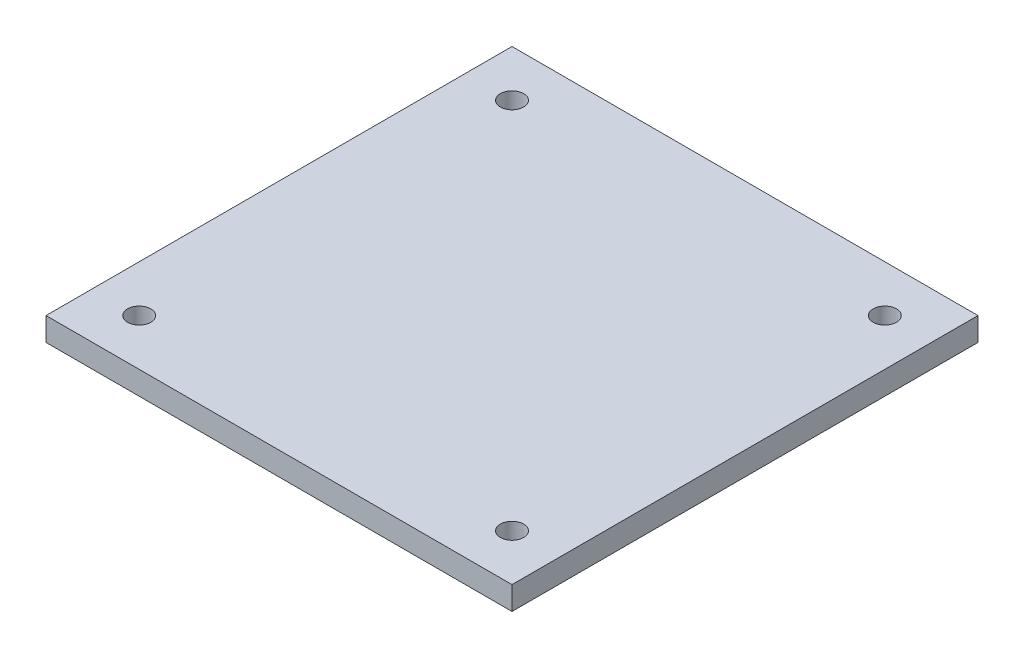
from build123d import *

# Parameters (mm, degrees)
SKETCH1_W           = 100
SKETCH1_H           = 100
BOSS_EXTRUDE1_DEPTH = 5


with BuildPart() as part:
    # Sketch1 → Boss-Extrude1 (new body)
    with BuildSketch(Plane(origin=(0, 0, 0), x_dir=(1, 0, 0), z_dir=(0, 1, 0))):
        Rectangle(SKETCH1_W, SKETCH1_H)
    extrude(amount=BOSS_EXTRUDE1_DEPTH)

    # Sketch4 → Ø5.0mm Dowel Hole1 (revolve, cut)
    with BuildSketch(Plane(origin=(40, 5, 40), x_dir=(0, 0, 1), z_dir=(1, 0, 0))):
        Polygon((0, 0), (0, 5), (2.525, 5), (2.5, 4.975), (2.5, 0), align=None)
    f_5_0mm_dowel_hole1 = revolve(axis=Axis((40, 11.35, 40), (0, -1, 0)), mode=Mode.SUBTRACT)

    # Mirror1: Ø5.0mm Dowel Hole1 across plane
    add(f_5_0mm_dowel_hole1.mirror(Plane(origin=(0, 0, 0), x_dir=(0, 0, 1), z_dir=(1, 0, 0))), mode=Mode.SUBTRACT)

    # Mirror1 at the second plane: Ø5.0mm Dowel Hole1 across plane
    add(f_5_0mm_dowel_hole1.mirror(Plane.XY), mode=Mode.SUBTRACT)

    # Mirror1 at the second plane copy 1 sketc → Mirror1 at the second plane copy 1 (revolve, cut)
    with BuildSketch(Plane(origin=(-40, 5, -40), x_dir=(0, 0, -1), z_dir=(-1, 0, 0))):
        Polygon((0, 0), (0, 5), (2.525, 5), (2.5, 4.975), (2.5, 0), align=None)
    revolve(axis=Axis((-40, 11.35, -40), (0, -1, 0)), mode=Mode.SUBTRACT)


solid = part.part
